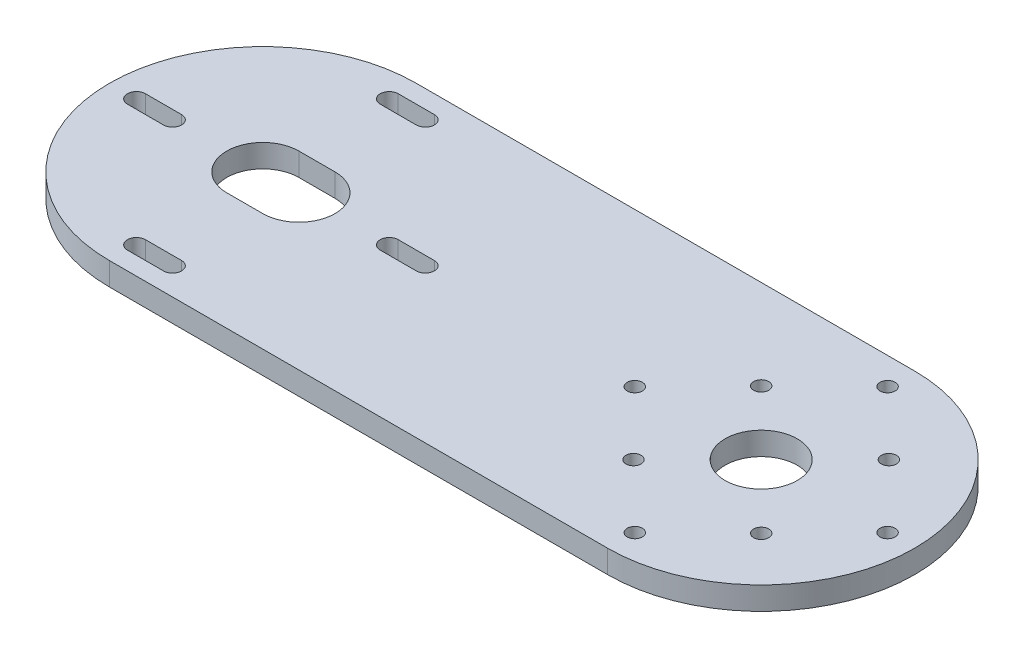
from build123d import *

# Parameters (mm, degrees)
SKETCH1_R           = 2.1
SKETCH1_R_2         = 10
BOSS_EXTRUDE1_DEPTH = 6.35


with BuildPart() as part:
    # Sketch1 → Boss-Extrude1 (new body)
    with BuildSketch(Plane(origin=(0, 0, 0), x_dir=(1, 0, 0), z_dir=(0, 1, 0))):
        with BuildLine():
            ThreePointArc((-138, 42.5), (-180.5, 0), (-138, -42.5))
            Line((-138, -42.5), (0, -42.5))
            ThreePointArc((0, -42.5), (42.5, 0), (0, 42.5))
            Line((0, 42.5), (-138, 42.5))
        make_face()
        with BuildLine():
            Line((-103, 2.5), (-93, 2.5))
            ThreePointArc((-93, 2.5), (-90.5, 0), (-93, -2.5))
            Line((-93, -2.5), (-103, -2.5))
            ThreePointArc((-103, -2.5), (-105.5, 0), (-103, 2.5))
        make_face(mode=Mode.SUBTRACT)
        with BuildLine():
            ThreePointArc((-138, -37.5), (-140.5, -35), (-138, -32.5))
            Line((-138, -32.5), (-128, -32.5))
            ThreePointArc((-128, -32.5), (-125.5, -35), (-128, -37.5))
            Line((-128, -37.5), (-138, -37.5))
        make_face(mode=Mode.SUBTRACT)
        with BuildLine():
            ThreePointArc((-173, -2.5), (-175.5, 0), (-173, 2.5))
            Line((-173, 2.5), (-163, 2.5))
            ThreePointArc((-163, 2.5), (-160.5, 0), (-163, -2.5))
            Line((-163, -2.5), (-173, -2.5))
        make_face(mode=Mode.SUBTRACT)
        with BuildLine():
            ThreePointArc((-138, -10), (-148, 0), (-138, 10))
            Line((-138, 10), (-128, 10))
            ThreePointArc((-128, 10), (-118, 0), (-128, -10))
            Line((-128, -10), (-138, -10))
        make_face(mode=Mode.SUBTRACT)
        with BuildLine():
            ThreePointArc((-138, 32.5), (-140.5, 35), (-138, 37.5))
            Line((-138, 37.5), (-128, 37.5))
            ThreePointArc((-128, 37.5), (-125.5, 35), (-128, 32.5))
            Line((-128, 32.5), (-138, 32.5))
        make_face(mode=Mode.SUBTRACT)
        with Locations(Location((0, 35, 0), (0, 0, 270))):
            Circle(SKETCH1_R, mode=Mode.SUBTRACT)
        with Locations(Location((0, -35, 0), (0, 0, 270))):
            Circle(SKETCH1_R, mode=Mode.SUBTRACT)
        with Locations(Location((-17.67766953, -17.67766953, 0), (0, 0, 270))):
            Circle(SKETCH1_R, mode=Mode.SUBTRACT)
        with Locations(Location((17.67766953, -17.67766953, 0), (0, 0, 270))):
            Circle(SKETCH1_R, mode=Mode.SUBTRACT)
        with Locations(Location((-35, 0, 0), (0, 0, 270))):
            Circle(SKETCH1_R, mode=Mode.SUBTRACT)
        with Locations(Location((-17.67766953, 17.67766953, 0), (0, 0, 270))):
            Circle(SKETCH1_R, mode=Mode.SUBTRACT)
        with Locations(Location((0, 0, 0), (0, 0, 270))):
            Circle(SKETCH1_R_2, mode=Mode.SUBTRACT)
        with Locations(Location((35, 0, 0), (0, 0, 270))):
            Circle(SKETCH1_R, mode=Mode.SUBTRACT)
        with Locations(Location((17.67766953, 17.67766953, 0), (0, 0, 270))):
            Circle(SKETCH1_R, mode=Mode.SUBTRACT)
    extrude(amount=-BOSS_EXTRUDE1_DEPTH)


solid = part.part
